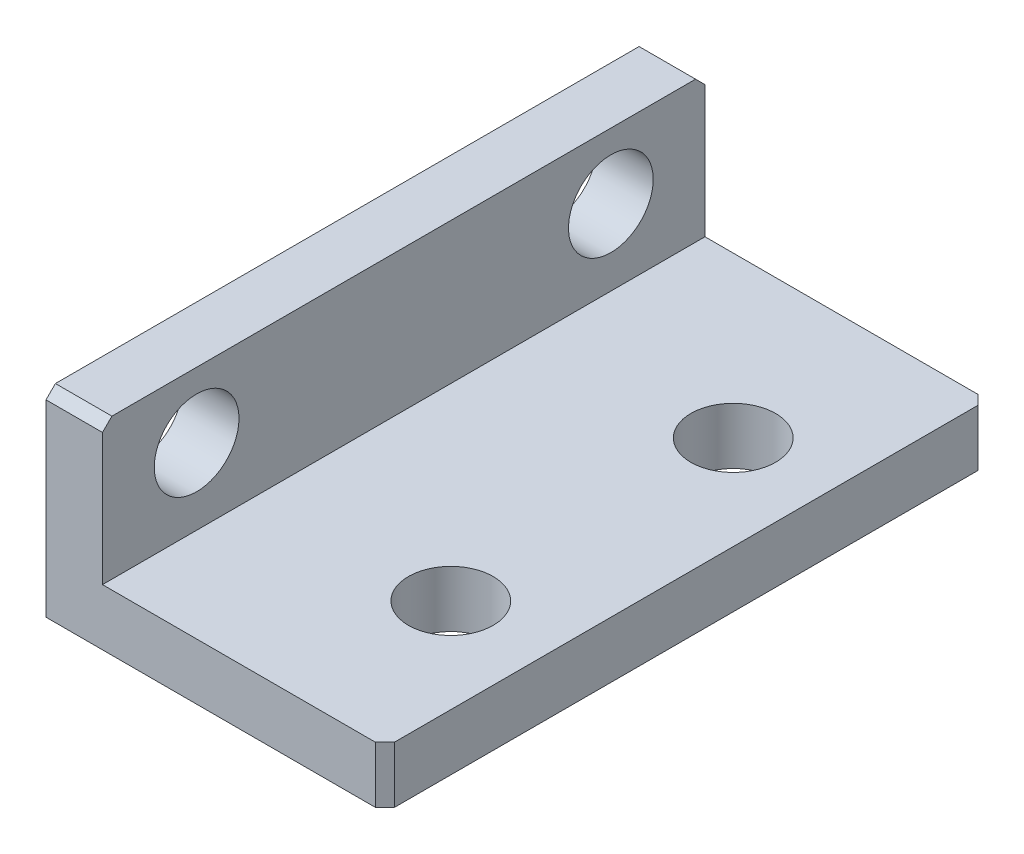
from build123d import *

# Parameters (mm, degrees)
EXTRUDE_1_DEPTH             = 16
HOLE_WIZARD_4_5_4_5_1_D     = 4.5
HOLE_WIZARD_4_5_4_5_1_DEPTH = 5
HOLE_WIZARD_4_5_4_5_1_TIP   = 1.351936393
HOLE_WIZARD_4_5_4_5_2_D     = 4.5
HOLE_WIZARD_4_5_4_5_2_DEPTH = 5
HOLE_WIZARD_4_5_4_5_2_TIP   = 1.351936393
CHAMFER_1_SIZE              = 0.5


with BuildPart() as part:
    # 草图6 → 拉伸-薄壁1 (new, symmetric)
    with BuildSketch(Plane.XY):
        Polygon((15, 0), (0, 0), (0, 7.5), (-3, 7.5), (-3, -3), (15, -3), align=None)
    extrude(amount=EXTRUDE_1_DEPTH, both=True)

    # Ø4.5 (4.5) 直径孔1
    with Locations(Plane(origin=(0, -1.729, -9.85), x_dir=(0, 0, 1), z_dir=(1, 0, 0))):
        with Locations((-1.15, -5.75), (20.85, -5.75)):
            Hole(HOLE_WIZARD_4_5_4_5_1_D / 2, depth=HOLE_WIZARD_4_5_4_5_1_DEPTH)
            with Locations((0, 0, -(HOLE_WIZARD_4_5_4_5_1_DEPTH + HOLE_WIZARD_4_5_4_5_1_TIP / 2))):  # 118° drill point
                Cone(0, HOLE_WIZARD_4_5_4_5_1_D / 2, HOLE_WIZARD_4_5_4_5_1_TIP, mode=Mode.SUBTRACT)

    # Ø4.5 (4.5) 直径孔2
    with Locations(Plane(origin=(0, 0, 0), x_dir=(1, 0, 0), z_dir=(0, 1, 0))):
        with Locations((10, -7.5), (10, 7.5)):
            Hole(HOLE_WIZARD_4_5_4_5_2_D / 2, depth=HOLE_WIZARD_4_5_4_5_2_DEPTH)
            with Locations((0, 0, -(HOLE_WIZARD_4_5_4_5_2_DEPTH + HOLE_WIZARD_4_5_4_5_2_TIP / 2))):  # 118° drill point
                Cone(0, HOLE_WIZARD_4_5_4_5_2_D / 2, HOLE_WIZARD_4_5_4_5_2_TIP, mode=Mode.SUBTRACT)

    # 倒角1
    chamfer_1_edges = [part.edges().sort_by_distance(p)[0] for p in [
        (-1.5, 7.5, 16),
        (-1.5, 7.5, -16),
        (15, -1.5, -16),
        (15, -1.5, 16),
    ]]
    chamfer(chamfer_1_edges, length=CHAMFER_1_SIZE)


solid = part.part
